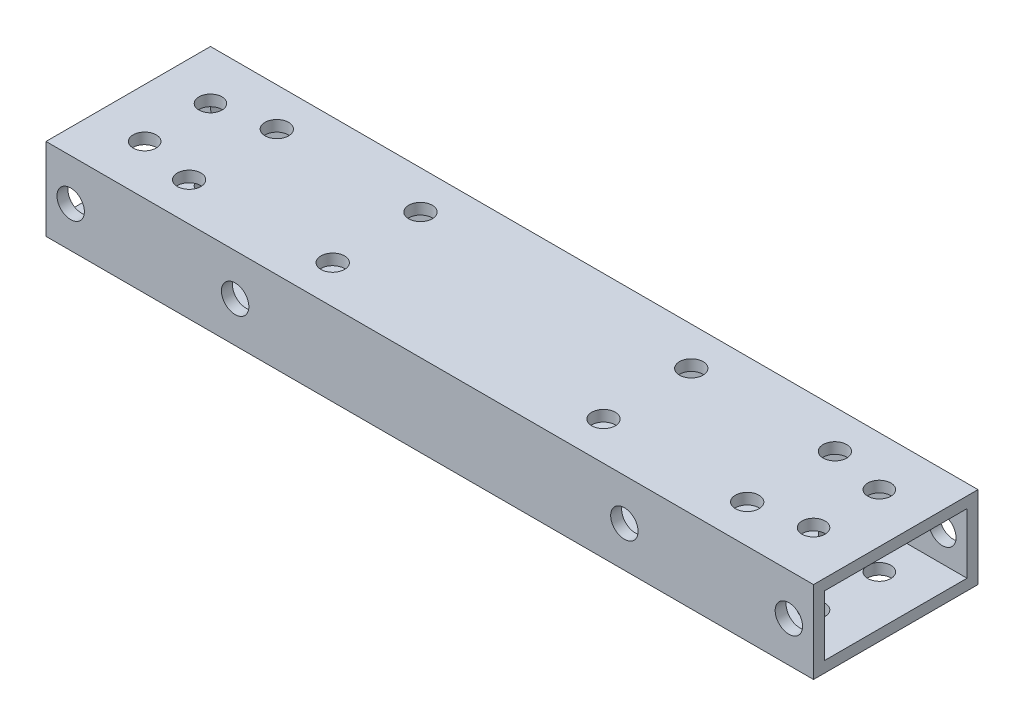
from build123d import *

# Parameters (mm, degrees)
SKETCH_1_W               = 30
SKETCH_1_H               = 15
SKETCH_1_W_2             = 26
SKETCH_1_H_2             = 11
EXTRUDE_1_DEPTH          = 140
SKETCH_2_R               = 2.15
CUT_EXTRUDE_1_DEPTH      = 144.961800489
CUT_EXTRUDE_2_DEPTH      = 144.961800489
CUT_EXTRUDE_2_DEPTH_BACK = 144.961800489
SKETCH_3_R               = 2.15
SKETCH_4_R               = 2.1
CUT_EXTRUDE_3_DEPTH      = 144.961800489
SKETCH_5_R               = 2.1
CUT_EXTRUDE_4_DEPTH      = 144.961800489
SKETCH_6_R               = 2.5
CUT_EXTRUDE_5_DEPTH      = 144.961800489


with BuildPart() as part:
    # 草图1 → 凸台-拉伸1 (new body)
    with BuildSketch(Plane(origin=(0, 0, 0), x_dir=(0, 0, -1), z_dir=(1, 0, 0))):
        with Locations((15, 7.5)):
            Rectangle(SKETCH_1_W, SKETCH_1_H)
        with Locations((15, 7.5)):
            Rectangle(SKETCH_1_W_2, SKETCH_1_H_2, mode=Mode.SUBTRACT)
    extrude(amount=EXTRUDE_1_DEPTH)

    # 草图2 → 切除-拉伸1 (cut, through all)
    with BuildSketch(Plane.XZ):
        with Locations(Location((19.1, -7, 0), (0, 0, 270))):
            Circle(SKETCH_2_R)
        with Locations(Location((19.1, -23, 0), (0, 0, 270))):
            Circle(SKETCH_2_R)
        with Locations(Location((45.3, -23, 0), (0, 0, 270))):
            Circle(SKETCH_2_R)
        with Locations(Location((45.3, -7, 0), (0, 0, 270))):
            Circle(SKETCH_2_R)
    extrude(amount=-CUT_EXTRUDE_1_DEPTH, mode=Mode.SUBTRACT)

    # 草图3 → 切除-拉伸2 (cut, two sides: drawn at the far end of the back side and taken through both)
    with BuildSketch(Plane.XZ.offset(-CUT_EXTRUDE_2_DEPTH_BACK)):
        with Locations(Location((94.7, -7, 0), (0, 0, 270))):
            Circle(SKETCH_3_R)
        with Locations(Location((120.9, -7, 0), (0, 0, 270))):
            Circle(SKETCH_3_R)
        with Locations(Location((120.9, -23, 0), (0, 0, 270))):
            Circle(SKETCH_3_R)
        with Locations(Location((94.7, -23, 0), (0, 0, 270))):
            Circle(SKETCH_3_R)
    extrude(amount=CUT_EXTRUDE_2_DEPTH + CUT_EXTRUDE_2_DEPTH_BACK, mode=Mode.SUBTRACT)

    # 草图4 → 切除-拉伸3 (cut, through all)
    with BuildSketch(Plane.XZ):
        with Locations(Location((131, -9, 0), (0, 0, 270))):
            Circle(SKETCH_4_R)
        with Locations(Location((131, -21, 0), (0, 0, 270))):
            Circle(SKETCH_4_R)
    extrude(amount=-CUT_EXTRUDE_3_DEPTH, mode=Mode.SUBTRACT)

    # 草图5 → 切除-拉伸4 (cut, through all)
    with BuildSketch(Plane.XZ):
        with Locations(Location((9, -9, 0), (0, 0, 270))):
            Circle(SKETCH_5_R)
        with Locations(Location((9, -21, 0), (0, 0, 270))):
            Circle(SKETCH_5_R)
    extrude(amount=-CUT_EXTRUDE_4_DEPTH, mode=Mode.SUBTRACT)

    # 草图6 → 切除-拉伸5 (cut, through all)
    with BuildSketch(Plane.XY):
        with Locations((4.5, 7.4)):
            Circle(SKETCH_6_R)
        with Locations((34.5, 7.4)):
            Circle(SKETCH_6_R)
        with Locations((105.5, 7.4)):
            Circle(SKETCH_6_R)
        with Locations((135.5, 7.4)):
            Circle(SKETCH_6_R)
    extrude(amount=-CUT_EXTRUDE_5_DEPTH, mode=Mode.SUBTRACT)


solid = part.part
